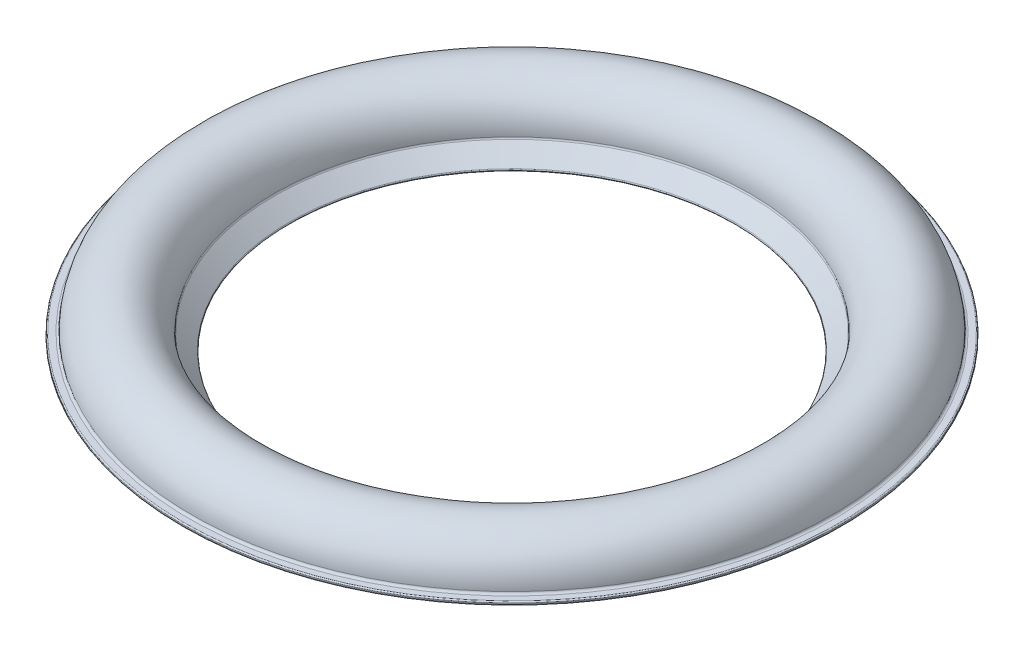
from build123d import *


with BuildPart() as part:
    # Sketch 250 → Повернуть3 (revolve)
    with BuildSketch(Plane.XY, mode=Mode.PRIVATE) as revolve_3_sk:
        with BuildLine():
            Line((95.343872324, 89.637023658), (95.687744648, 89.274047316))
            ThreePointArc((95.687744648, 89.274047316), (96.037212409, 89.118102155), (96.394593314, 89.254943298))
            Line((96.394593314, 89.254943298), (102.855572201, 95.375870665))
            Line((102.855572201, 95.375870665), (103.467612479, 95.987910943))
            ThreePointArc((103.467612479, 95.987910943), (103.686425269, 96.317296996), (103.760448118, 96.705748828))
            ThreePointArc((103.760448118, 96.705748828), (119.909002246, 112.876748248), (135.752604927, 96.406858244))
            ThreePointArc((135.752604927, 96.406858244), (136.034742253, 95.680815933), (136.752172307, 95.377446479))
            Line((136.752172307, 95.377446479), (140.759526839, 95.377446479))
            ThreePointArc((140.759526839, 95.377446479), (141.11308023, 95.523893089), (141.259526839, 95.877446479))
            Line((141.259526839, 95.877446479), (141.259526839, 96.377446479))
            ThreePointArc((141.259526839, 96.377446479), (141.11308023, 96.73099987), (140.759526839, 96.877446479))
            Line((140.759526839, 96.877446479), (138.232480041, 96.877446479))
            ThreePointArc((138.232480041, 96.877446479), (137.544749736, 97.151480208), (137.23394203, 97.823392425))
            ThreePointArc((137.23394203, 97.823392425), (119.492084975, 114.375402784), (102.264364743, 97.288911212))
            ThreePointArc((102.264364743, 97.288911212), (102.178557417, 96.906520614), (101.952385842, 96.586470798))
            Line((101.952385842, 96.586470798), (95.362976342, 90.343872324))
            ThreePointArc((95.362976342, 90.343872324), (95.207031181, 89.994404563), (95.343872324, 89.637023658))
        make_face()
    revolve(revolve_3_sk.sketch.rotate(Axis((0, 0, 0), (0, 1, 0)), 90), axis=Axis((0, 0, 0), (0, 1, 0)))


solid = part.part
